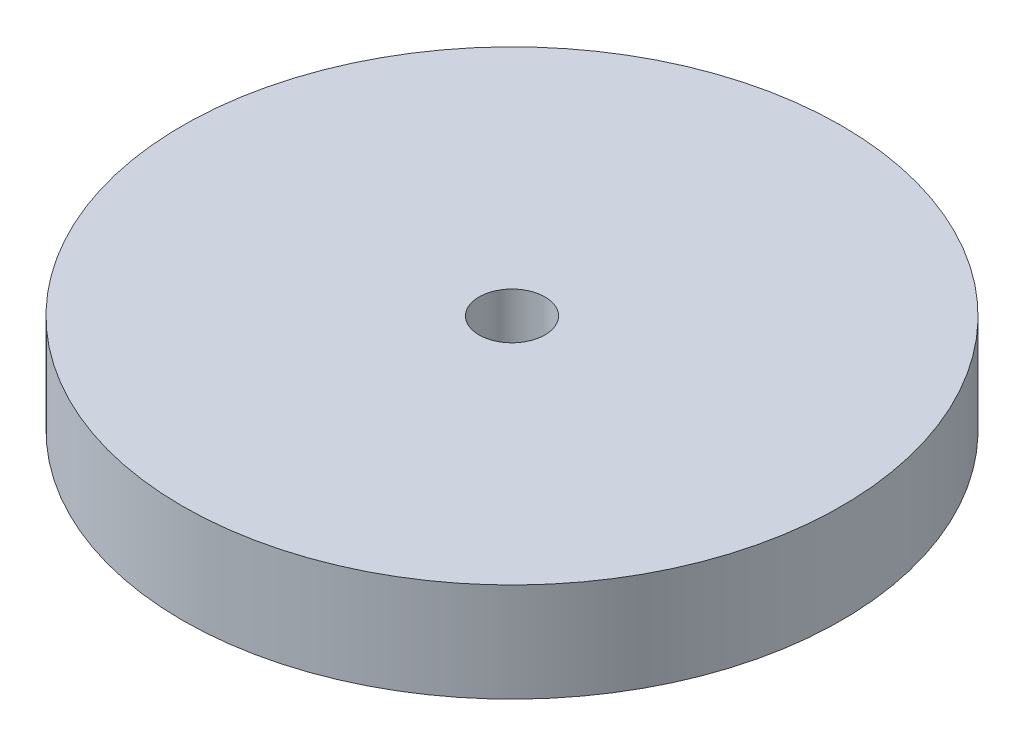
from build123d import *

# Parameters (mm, degrees)
SKETCH1_R           = 10
BOSS_EXTRUDE1_DEPTH = 3
SKETCH2_R           = 1
CUT_EXTRUDE1_DEPTH  = 10


with BuildPart() as part:
    # Sketch1 → Boss-Extrude1 (new body)
    with BuildSketch(Plane(origin=(0, 0, 0), x_dir=(1, 0, 0), z_dir=(0, 1, 0))):
        with Locations(Location((0, 0, 0), (0, 0, 270))):
            Circle(SKETCH1_R)
    extrude(amount=BOSS_EXTRUDE1_DEPTH)

    # Sketch2 → Cut-Extrude1 (cut)
    with BuildSketch(Plane(origin=(0, 3, 0), x_dir=(1, 0, 0), z_dir=(0, 1, 0))):
        with Locations(Location((0, 0, 0), (0, 0, 270))):
            Circle(SKETCH2_R)
    extrude(amount=-CUT_EXTRUDE1_DEPTH, mode=Mode.SUBTRACT)


solid = part.part
